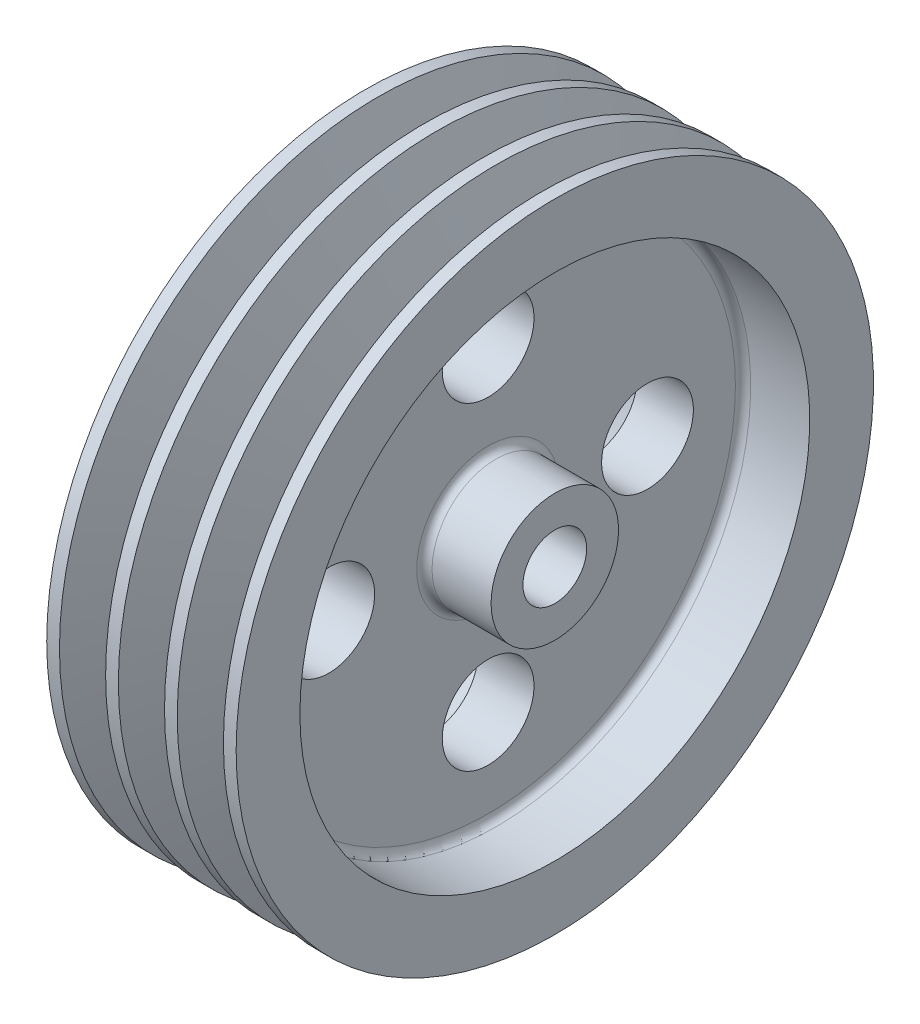
from build123d import *

# Parameters (mm, degrees)
SKETCH2_R          = 18
CUT_EXTRUDE1_DEPTH = 169


with BuildPart() as part:
    # Sketch1 → Revolve1 (revolve)
    with BuildSketch(Plane.XY, mode=Mode.PRIVATE) as revolve1_sk:
        with BuildLine():
            Line((-37.15439265, -12.5), (-14, -12.5))
            ThreePointArc((-14, -12.5), (-11.878679656, -13.378679656), (-11, -15.5))
            Line((-11, -15.5), (-11, -84.5))
            ThreePointArc((-11, -84.5), (-11.878679656, -86.621320344), (-14, -87.5))
            Line((-14, -87.5), (-34.15439265, -87.5))
            ThreePointArc((-34.15439265, -87.5), (-36.275712994, -88.378679656), (-37.15439265, -90.5))
            Line((-37.15439265, -90.5), (-37.15439265, -100))
            Line((-37.15439265, -100), (37.15439265, -100))
            Line((37.15439265, -100), (37.15439265, -87.5))
            Line((37.15439265, -87.5), (14, -87.5))
            ThreePointArc((14, -87.5), (11.878679656, -86.621320344), (11, -84.5))
            Line((11, -84.5), (11, -15.5))
            ThreePointArc((11, -15.5), (11.878679656, -13.378679656), (14, -12.5))
            Line((14, -12.5), (37.15439265, -12.5))
            Line((37.15439265, -12.5), (37.15439265, 12.5))
            Line((37.15439265, 12.5), (32.15439265, 12.5))
            Line((32.15439265, 12.5), (25.602928434, -5.5))
            Line((25.602928434, -5.5), (20.602928434, -5.5))
            Line((20.602928434, -5.5), (14.051464217, 12.5))
            Line((14.051464217, 12.5), (9.051464217, 12.5))
            Line((9.051464217, 12.5), (2.5, -5.5))
            Line((2.5, -5.5), (-2.5, -5.5))
            Line((-2.5, -5.5), (-9.051464217, 12.5))
            Line((-9.051464217, 12.5), (-14.051464217, 12.5))
            Line((-14.051464217, 12.5), (-20.602928434, -5.5))
            Line((-20.602928434, -5.5), (-25.602928434, -5.5))
            Line((-25.602928434, -5.5), (-32.15439265, 12.5))
            Line((-32.15439265, 12.5), (-37.15439265, 12.5))
            Line((-37.15439265, 12.5), (-37.15439265, -12.5))
        make_face()
    revolve(revolve1_sk.sketch.rotate(Axis((-92.43329882, -112.5, 0), (1, 0, 0)), 90), axis=Axis((-92.43329882, -112.5, 0), (1, 0, 0)))

    # Sketch2 → Cut-Extrude1 (cut)
    with BuildSketch(Plane.ZY.offset(11)):
        with Locations((0, -50)):
            Circle(SKETCH2_R)
        with Locations((62.5, -112.5)):
            Circle(SKETCH2_R)
        with Locations((0, -175)):
            Circle(SKETCH2_R)
        with Locations((-62.5, -112.5)):
            Circle(SKETCH2_R)
    extrude(amount=-CUT_EXTRUDE1_DEPTH, mode=Mode.SUBTRACT)


solid = part.part
